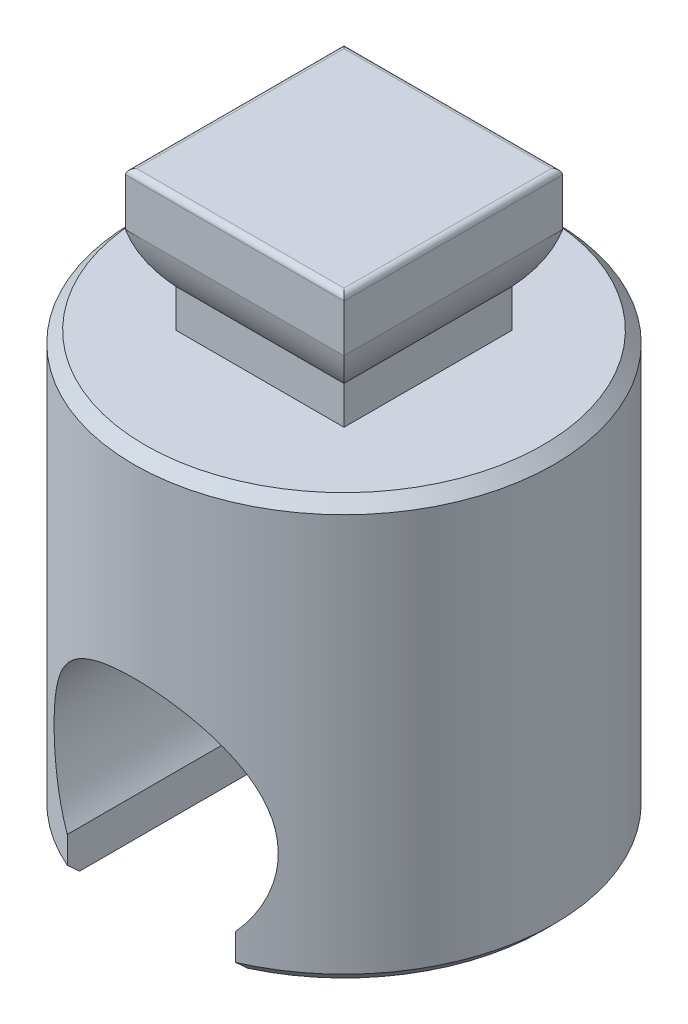
from build123d import *

# Parameters (mm, degrees)
SKETCH_1_R                      = 3.75
EXTRUDE_1_DEPTH                 = 7.5
EXTRUDE_2_DEPTH                 = 2
EXTRUDE_2_DEPTH_BACK            = 2
CUT_EXTRUDE_1_DEPTH             = 2
CUT_EXTRUDE_1_DEPTH_BACK        = 2
CUT_EXTRUDE_2_REACH             = 11.186
CUT_EXTRUDE_2_DIRECTION_2_REACH = 11.186
FILLET_1_R                      = 0.1
SKETCH_5_R                      = 0.75
CUT_EXTRUDE_3_DEPTH             = 6
CHAMFER_1_SIZE                  = 0.2


with BuildPart() as part:
    # 草图1 → 凸台-拉伸1 (new body)
    with BuildSketch(Plane(origin=(0, 0, 0), x_dir=(1, 0, 0), z_dir=(0, 1, 0))):
        Circle(SKETCH_1_R)
    extrude(amount=-EXTRUDE_1_DEPTH)

    # 草图2 → 凸台-拉伸2 (add, two sides: drawn at the far end of the back side and taken through both)
    with BuildSketch(Plane.XY.offset(-EXTRUDE_2_DEPTH_BACK)):
        with BuildLine():
            Line((-1.95, 2.5), (1.95, 2.5))
            Line((1.95, 2.5), (1.95, 1.555590279))
            ThreePointArc((1.95, 1.555590279), (1.780042303, 1.088161527), (1.5, 0.677124344))
            Line((1.5, 0.677124344), (1.5, 0))
            Line((1.5, 0), (-1.5, 0))
            Line((-1.5, 0), (-1.5, 0.677124344))
            ThreePointArc((-1.5, 0.677124344), (-1.780042303, 1.088161527), (-1.95, 1.555590279))
            Line((-1.95, 1.555590279), (-1.95, 2.5))
        make_face()
    extrude(amount=EXTRUDE_2_DEPTH + EXTRUDE_2_DEPTH_BACK)

    # 草图3 → 切除-拉伸1 (cut, two sides: drawn at the far end of the back side and taken through both)
    with BuildSketch(Plane(origin=(0, 0, 0), x_dir=(0, 0, -1), z_dir=(1, 0, 0)).offset(-CUT_EXTRUDE_1_DEPTH_BACK)):
        with BuildLine():
            Line((1.95, 2.5), (1.95, 1.555590279))
            ThreePointArc((1.95, 1.555590279), (1.780042303, 1.088161527), (1.5, 0.677124344))
            Line((1.5, 0.677124344), (1.5, 0))
            Line((1.5, 0), (2, 0))
            Line((2, 0), (2, 2.5))
            Line((2, 2.5), (1.95, 2.5))
        make_face()
        with BuildLine():
            Line((-2, 0), (-1.5, 0))
            Line((-1.5, 0), (-1.5, 0.677124344))
            ThreePointArc((-1.5, 0.677124344), (-1.780042303, 1.088161527), (-1.95, 1.555590279))
            Line((-1.95, 1.555590279), (-1.95, 2.5))
            Line((-1.95, 2.5), (-2, 2.5))
            Line((-2, 2.5), (-2, 0))
        make_face()
    extrude(amount=CUT_EXTRUDE_1_DEPTH + CUT_EXTRUDE_1_DEPTH_BACK, mode=Mode.SUBTRACT)

    # 草图4 → 切除-拉伸2 (cut, up to next)
    with BuildSketch(Plane.XY, mode=Mode.PRIVATE) as cut_extrude_2_sk1:
        with BuildLine():
            Line((-1.5, -7.5), (1.5, -7.5))
            Line((1.5, -7.5), (1.5, -6.822875656))
            ThreePointArc((1.5, -6.822875656), (0, -3.5), (-1.5, -6.822875656))
            Line((-1.5, -6.822875656), (-1.5, -7.5))
        make_face()
    cut_extrude_2_tool1 = extrude(cut_extrude_2_sk1.sketch, amount=-CUT_EXTRUDE_2_REACH, mode=Mode.PRIVATE) & part.part
    add(cut_extrude_2_tool1.solids().sort_by_distance((0, -5.585293, 0))[0], mode=Mode.SUBTRACT)

    # 草图4 → 切除-拉伸2 direction 2 (cut, up to next)
    with BuildSketch(Plane.XY, mode=Mode.PRIVATE) as cut_extrude_2_direction_2_sk1:
        with BuildLine():
            Line((-1.5, -7.5), (1.5, -7.5))
            Line((1.5, -7.5), (1.5, -6.822875656))
            ThreePointArc((1.5, -6.822875656), (0, -3.5), (-1.5, -6.822875656))
            Line((-1.5, -6.822875656), (-1.5, -7.5))
        make_face()
    cut_extrude_2_direction_2_tool1 = extrude(cut_extrude_2_direction_2_sk1.sketch, amount=CUT_EXTRUDE_2_DIRECTION_2_REACH, mode=Mode.PRIVATE) & part.part
    add(cut_extrude_2_direction_2_tool1.solids().sort_by_distance((0, -5.585293, 0))[0], mode=Mode.SUBTRACT)

    # 圆角1
    fillet_1_edges = [part.edges().sort_by_distance(p)[0] for p in [
        (0, 2.5, 1.95),
        (-1.95, 2.5, 0),
        (0, 2.5, -1.95),
        (1.95, 2.5, 0),
    ]]
    fillet(fillet_1_edges, radius=FILLET_1_R)

    # 草图5 → 切除-拉伸3 (cut)
    with BuildSketch(Plane.XZ.offset(7.5)):
        Circle(SKETCH_5_R)
    extrude(amount=-CUT_EXTRUDE_3_DEPTH, mode=Mode.SUBTRACT)

    # 倒角1
    chamfer_1_edges = [part.edges().sort_by_distance(p)[0] for p in [
        (-3.75, -7.5, 0),
        (3.1374751, -7.5, 2.053959591),
        (-3.75, 0, 0),
    ]]
    chamfer(chamfer_1_edges, length=CHAMFER_1_SIZE)


solid = part.part
